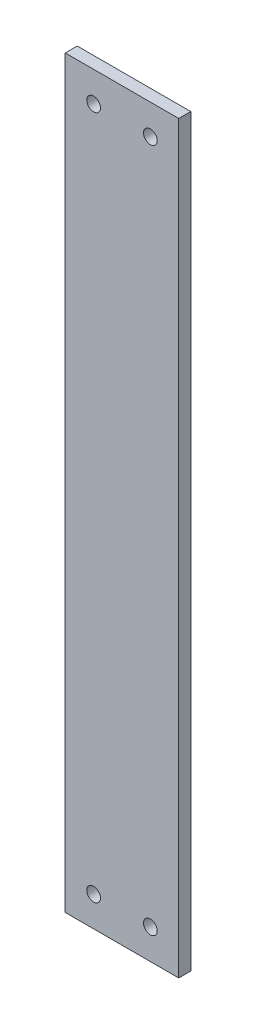
from build123d import *

# Parameters (mm, degrees)
ESQUISSE1_W        = 34
ESQUISSE1_H        = 223
ESQUISSE1_R        = 2.05
BOSS_EXTRU_1_DEPTH = 3.6


with BuildPart() as part:
    # Esquisse1 → Boss.-Extru.1 (new body)
    with BuildSketch(Plane.XY):
        Rectangle(ESQUISSE1_W, ESQUISSE1_H)
        with Locations((-8.5, 102.5)):
            Circle(ESQUISSE1_R, mode=Mode.SUBTRACT)
        with Locations(Location((-8.5, -102.5, 0), (0, 0, 180))):
            Circle(ESQUISSE1_R, mode=Mode.SUBTRACT)
        with Locations((8.5, -102.5)):
            Circle(ESQUISSE1_R, mode=Mode.SUBTRACT)
        with Locations(Location((8.5, 102.5, 0), (0, 0, 180))):
            Circle(ESQUISSE1_R, mode=Mode.SUBTRACT)
    extrude(amount=BOSS_EXTRU_1_DEPTH)


solid = part.part
